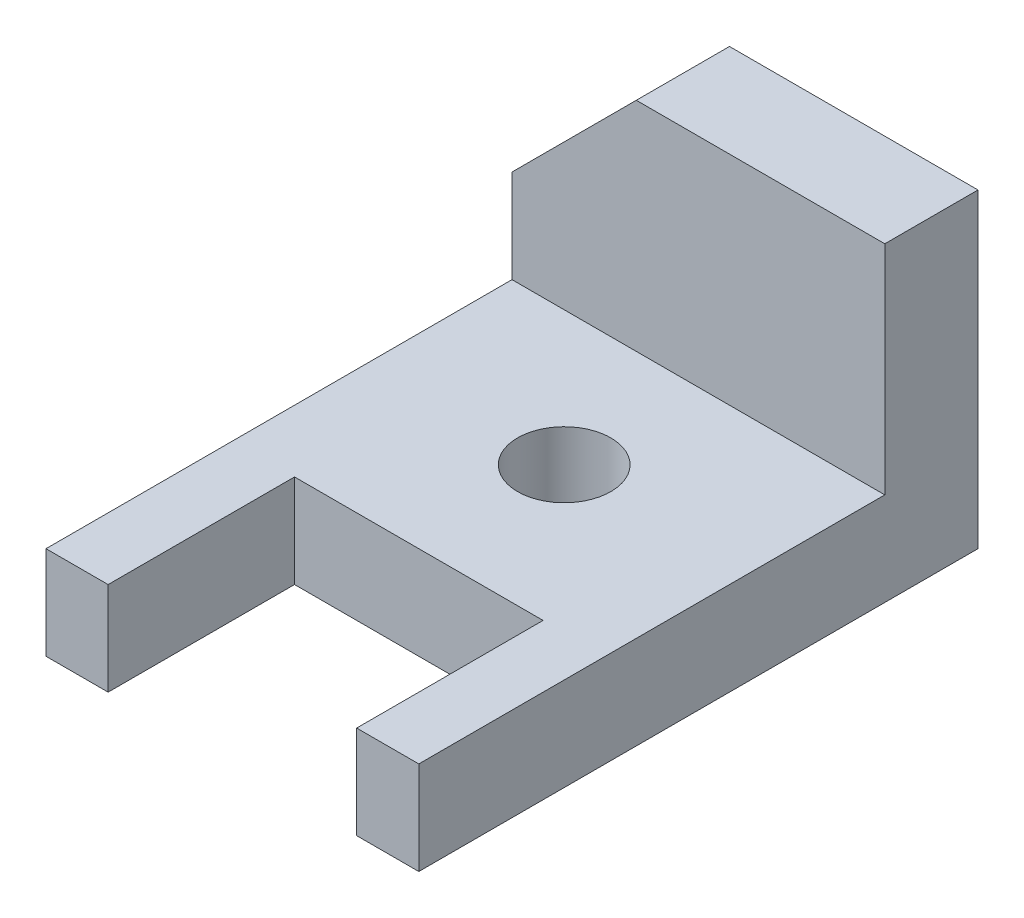
from build123d import *

# Parameters (mm, degrees)
SKETCH1_W                   = 76.2
SKETCH1_H                   = 114.3
BOSS_EXTRUDE1_DEPTH         = 19.05
SKETCH3_W                   = 76.2
SKETCH3_H                   = 19.05
BOSS_EXTRUDE2_DEPTH         = 63.5
F_3_4_0_75_DIAMETER_HOLE1_D = 19.05
SKETCH10_W                  = 50.8
SKETCH10_H                  = 19.05
BOSS_EXTRUDE3_DEPTH         = 38.1
SKETCH12_W                  = 50.8
SKETCH12_H                  = 19.05
CUT_EXTRUDE1_DEPTH          = 38.1
CUT_EXTRUDE2_DEPTH          = 38.1


with BuildPart() as part:
    # Sketch1 → Boss-Extrude1 (new body)
    with BuildSketch(Plane(origin=(0, 0, 0), x_dir=(1, 0, 0), z_dir=(0, 1, 0))):
        with Locations((-135.384466019, 36.065533981)):
            Rectangle(SKETCH1_W, SKETCH1_H)
    extrude(amount=BOSS_EXTRUDE1_DEPTH)

    # Sketch3 → Boss-Extrude2 (add)
    with BuildSketch(Plane.XZ):
        with Locations((-135.384466019, -83.690533981)):
            Rectangle(SKETCH3_W, SKETCH3_H)
    extrude(amount=-BOSS_EXTRUDE2_DEPTH)

    # 3/4 (0.75) Diameter Hole1 (through all)
    with Locations(Plane(origin=(0, 19.05, 0), x_dir=(1, 0, 0), z_dir=(0, 1, 0))):
        with Locations((-135.384466019, 46.733533981)):
            Hole(F_3_4_0_75_DIAMETER_HOLE1_D / 2)

    # Sketch10 → Boss-Extrude3 (add)
    with BuildSketch(Plane.XY.offset(21.084466019)):
        with Locations((-135.384466019, 9.525)):
            Rectangle(SKETCH10_W, SKETCH10_H)
    extrude(amount=-BOSS_EXTRUDE3_DEPTH)

    # Sketch12 → Cut-Extrude1 (cut)
    with BuildSketch(Plane.XY.offset(21.084466019)):
        with Locations((-135.384466019, 9.525)):
            Rectangle(SKETCH12_W, SKETCH12_H)
    extrude(amount=-CUT_EXTRUDE1_DEPTH, mode=Mode.SUBTRACT)

    # Sketch13 → Cut-Extrude2 (cut)
    with BuildSketch(Plane.XY.offset(-74.165533981)):
        Polygon((-173.484466019, 38.1), (-148.084466019, 63.5), (-173.484466019, 63.5), align=None)
    extrude(amount=-CUT_EXTRUDE2_DEPTH, mode=Mode.SUBTRACT)


solid = part.part
